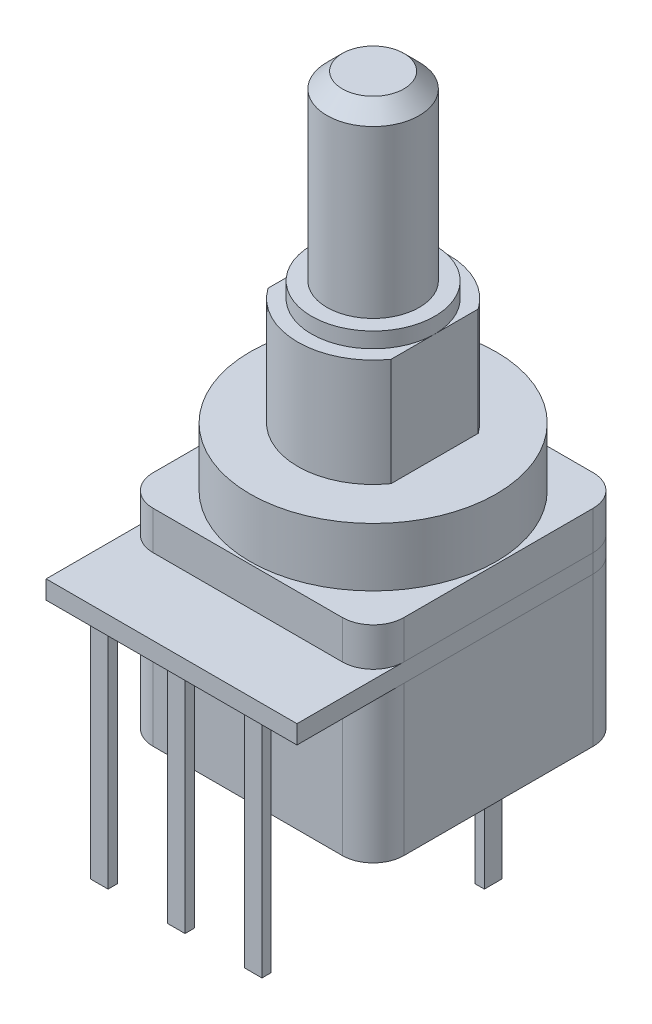
from build123d import *

# Parameters (mm, degrees)
CROQUIS1_W                   = 16.3
CROQUIS1_H                   = 16.3
SALIENTE_EXTRUIR1_DEPTH      = 9.7
REDONDEO1_R                  = 2
SALIENTE_EXTRUIR2_DEPTH      = 1.2
SALIENTE_EXTRUIR3_DEPTH      = 2.5
CROQUIS4_R                   = 8
SALIENTE_EXTRUIR4_DEPTH      = 3.8
SALIENTE_EXTRUIR5_DEPTH      = 7
CROQUIS7_R                   = 4
SALIENTE_EXTRUIR6_DEPTH      = 1
SALIENTE_EXTRUIR7_DEPTH      = 11.8
SALIENTE_EXTRUIR7_DEPTH_BACK = 1
CROQUIS8_R                   = 3
CHAFL_N1_SIZE                = 1
CROQUIS9_W                   = 1.15
CROQUIS9_H                   = 0.6
SALIENTE_EXTRUIR8_DEPTH      = 4.85
CROQUIS9_W_2                 = 0.6
CROQUIS9_H_2                 = 1.15
SALIENTE_EXTRUIR8_2_DEPTH    = 4.85
SALIENTE_EXTRUIR8_3_DEPTH    = 4.85
CROQUIS10_W                  = 1.15
CROQUIS10_H                  = 0.6
SALIENTE_EXTRUIR9_DEPTH      = 15.75
SALIENTE_EXTRUIR9_2_DEPTH    = 15.75
SALIENTE_EXTRUIR9_3_DEPTH    = 15.75


with BuildPart() as part:
    # Croquis1 → Saliente-Extruir1 (new body)
    with BuildSketch(Plane(origin=(0, 0, 0), x_dir=(1, 0, 0), z_dir=(0, 1, 0))):
        Rectangle(CROQUIS1_W, CROQUIS1_H)
    extrude(amount=-SALIENTE_EXTRUIR1_DEPTH)

    # Redondeo1
    redondeo1_edges = [part.edges().sort_by_distance(p)[0] for p in [
        (8.15, -4.85, 8.15),
        (-8.15, -4.85, 8.15),
        (-8.15, -4.85, -8.15),
        (8.15, -4.85, -8.15),
    ]]
    fillet(redondeo1_edges, radius=REDONDEO1_R)


with BuildPart() as body_2:
    # Croquis2 → Saliente-Extruir2 (new body)
    with BuildSketch(Plane(origin=(0, 0, 0), x_dir=(1, 0, 0), z_dir=(0, 1, 0))):
        with BuildLine():
            Line((-8.15, -13.1), (8.15, -13.1))
            Line((8.15, -13.1), (8.15, 6.15))
            ThreePointArc((8.15, 6.15), (7.564213562, 7.564213562), (6.15, 8.15))
            Line((6.15, 8.15), (-6.15, 8.15))
            ThreePointArc((-6.15, 8.15), (-7.564213562, 7.564213562), (-8.15, 6.15))
            Line((-8.15, 6.15), (-8.15, -13.1))
        make_face()
    extrude(amount=SALIENTE_EXTRUIR2_DEPTH)


with BuildPart() as body_3:
    # Croquis3 → Saliente-Extruir3 (new body)
    with BuildSketch(Plane(origin=(0, 1.2, 0), x_dir=(1, 0, 0), z_dir=(0, 1, 0))):
        with BuildLine():
            Line((8.15, -6.15), (8.15, 6.15))
            ThreePointArc((8.15, 6.15), (7.564213562, 7.564213562), (6.15, 8.15))
            Line((6.15, 8.15), (-6.15, 8.15))
            ThreePointArc((-6.15, 8.15), (-7.564213562, 7.564213562), (-8.15, 6.15))
            Line((-8.15, 6.15), (-8.15, -6.15))
            ThreePointArc((-8.15, -6.15), (-7.564213562, -7.564213562), (-6.15, -8.15))
            Line((-6.15, -8.15), (6.15, -8.15))
            ThreePointArc((6.15, -8.15), (7.564213562, -7.564213562), (8.15, -6.15))
        make_face()
    extrude(amount=SALIENTE_EXTRUIR3_DEPTH)

    # Croquis4 → Saliente-Extruir4 (add)
    with BuildSketch(Plane(origin=(0, 3.7, 0), x_dir=(1, 0, 0), z_dir=(0, 1, 0))):
        with Locations(Location((0, 0, 0), (0, 0, 90))):
            Circle(CROQUIS4_R)
    extrude(amount=SALIENTE_EXTRUIR4_DEPTH)

    # Croquis6 → Saliente-Extruir5 (add)
    with BuildSketch(Plane(origin=(0, 7.5, 0), x_dir=(1, 0, 0), z_dir=(0, 1, 0))):
        with BuildLine():
            Line((-4, 2.83019434), (-4, -2.83019434))
            ThreePointArc((-4, -2.83019434), (0, -4.9), (4, -2.83019434))
            Line((4, -2.83019434), (4, 2.83019434))
            ThreePointArc((4, 2.83019434), (0, 4.9), (-4, 2.83019434))
        make_face()
    extrude(amount=SALIENTE_EXTRUIR5_DEPTH)

    # Croquis7 → Saliente-Extruir6 (add)
    with BuildSketch(Plane(origin=(0, 14.5, 0), x_dir=(1, 0, 0), z_dir=(0, 1, 0))):
        with Locations(Location((0, 0, 0), (0, 0, 180))):
            Circle(CROQUIS7_R)
    extrude(amount=SALIENTE_EXTRUIR6_DEPTH)


with BuildPart() as body_4:
    # Croquis8 → Saliente-Extruir7 (new, two sides: drawn at the far end of the back side and taken through both)
    with BuildSketch(Plane(origin=(0, 15.5, 0), x_dir=(1, 0, 0), z_dir=(0, 1, 0)).offset(-SALIENTE_EXTRUIR7_DEPTH_BACK)):
        with Locations(Location((0, 0, 0), (0, 0, 270))):
            Circle(CROQUIS8_R)
    extrude(amount=SALIENTE_EXTRUIR7_DEPTH + SALIENTE_EXTRUIR7_DEPTH_BACK)

    # Chaflán1
    chafl_n1_edges = [body_4.edges().sort_by_distance(p)[0] for p in [
        (0, 27.3, -3),
    ]]
    chamfer(chafl_n1_edges, length=CHAFL_N1_SIZE)


with BuildPart() as body_5:
    # Croquis9 → Saliente-Extruir8 (new body)
    with BuildSketch(Plane.XZ.offset(9.7)):
        with Locations((0, -7.5)):
            Rectangle(CROQUIS9_W, CROQUIS9_H)
    extrude(amount=SALIENTE_EXTRUIR8_DEPTH)


with BuildPart() as body_6:
    # Croquis9 → Saliente-Extruir8 2 (new body)
    with BuildSketch(Plane.XZ.offset(9.7)):
        with Locations((7.5, 0)):
            Rectangle(CROQUIS9_W_2, CROQUIS9_H_2)
    extrude(amount=SALIENTE_EXTRUIR8_2_DEPTH)


with BuildPart() as body_7:
    # Croquis9 → Saliente-Extruir8 3 (new body)
    with BuildSketch(Plane.XZ.offset(9.7)):
        with Locations((-7.5, 0)):
            Rectangle(CROQUIS9_W_2, CROQUIS9_H_2)
    extrude(amount=SALIENTE_EXTRUIR8_3_DEPTH)


with BuildPart() as body_8:
    # Croquis10 → Saliente-Extruir9 (new body)
    with BuildSketch(Plane(origin=(0, 1.2, 0), x_dir=(1, 0, 0), z_dir=(0, 1, 0))):
        with Locations((-5, -12.5)):
            Rectangle(CROQUIS10_W, CROQUIS10_H)
    extrude(amount=-SALIENTE_EXTRUIR9_DEPTH)


with BuildPart() as body_9:
    # Croquis10 → Saliente-Extruir9 2 (new body)
    with BuildSketch(Plane(origin=(0, 1.2, 0), x_dir=(1, 0, 0), z_dir=(0, 1, 0))):
        with Locations((5, -12.5)):
            Rectangle(CROQUIS10_W, CROQUIS10_H)
    extrude(amount=-SALIENTE_EXTRUIR9_2_DEPTH)


with BuildPart() as body_10:
    # Croquis10 → Saliente-Extruir9 3 (new body)
    with BuildSketch(Plane(origin=(0, 1.2, 0), x_dir=(1, 0, 0), z_dir=(0, 1, 0))):
        with Locations((0, -12.5)):
            Rectangle(CROQUIS10_W, CROQUIS10_H)
    extrude(amount=-SALIENTE_EXTRUIR9_3_DEPTH)


solid = Compound([part.part, body_2.part, body_3.part, body_4.part, body_5.part, body_6.part, body_7.part, body_8.part, body_9.part, body_10.part])
